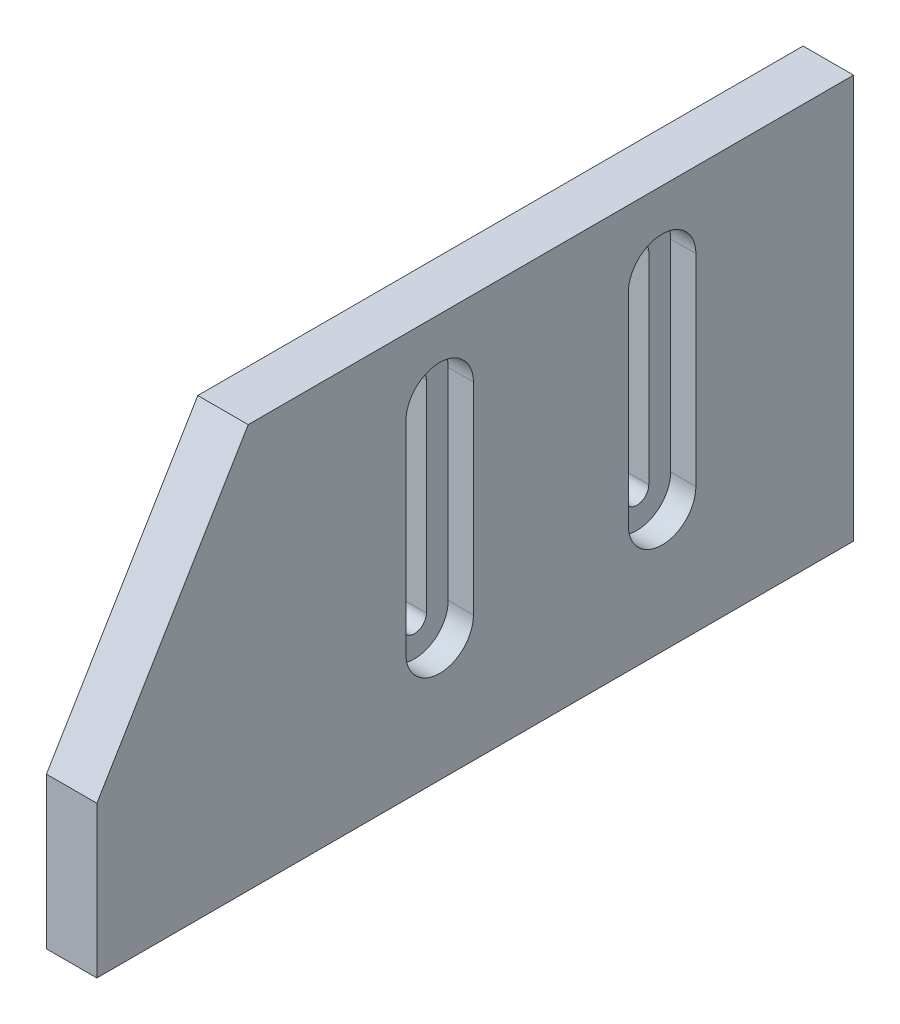
from build123d import *

# Parameters (mm, degrees)
BOSS_EXTRUDE2_DEPTH     = 3.175
CUT_EXTRUDE1_DEPTH      = 63.861792847
CUT_EXTRUDE1_DEPTH_BACK = 63.861792847
CUT_EXTRUDE3_START      = -3.175
CUT_EXTRUDE3_DEPTH      = 3.175
CUT_EXTRUDE2_DEPTH      = 77.530014537
CUT_EXTRUDE2_DEPTH_BACK = 15.24
SKETCH4_R               = 1.27


with BuildPart() as part:
    # Sketch2 → Boss-Extrude2 (new, symmetric)
    with BuildSketch(Plane(origin=(0, 0, 0), x_dir=(0, 0, -1), z_dir=(1, 0, 0))):
        Polygon((-57.15, -25.4), (38.1, -25.4), (38.1, 25.4), (-38.1, 25.4), (-57.15, -6.35), align=None)
    extrude(amount=BOSS_EXTRUDE2_DEPTH, both=True)

    # Sketch3 → Cut-Extrude1 (cut, two sides: drawn at the far end of the back side and taken through both)
    with BuildSketch(Plane(origin=(3.175, 0, 0), x_dir=(0, 0, -1), z_dir=(1, 0, 0)).offset(-CUT_EXTRUDE1_DEPTH_BACK)):
        with BuildLine():
            Line((-15.500000048, 15.875), (-15.500000048, -9.525))
            ThreePointArc((-15.500000048, -9.525), (-14, -11.025000048), (-12.499999952, -9.525))
            Line((-12.499999952, -9.525), (-12.499999952, 15.875))
            ThreePointArc((-12.499999952, 15.875), (-14, 17.375000048), (-15.500000048, 15.875))
        make_face()
        with BuildLine():
            Line((12.499999952, 15.875), (12.499999952, -9.525))
            ThreePointArc((12.499999952, -9.525), (14, -11.025000048), (15.500000048, -9.525))
            Line((15.500000048, -9.525), (15.500000048, 15.875))
            ThreePointArc((15.500000048, 15.875), (14, 17.375000048), (12.499999952, 15.875))
        make_face()
    extrude(amount=CUT_EXTRUDE1_DEPTH + CUT_EXTRUDE1_DEPTH_BACK, mode=Mode.SUBTRACT)

    # Sketch3<3> → Cut-Extrude3 (cut)
    # profile 1 of 2: a face of its own
    with BuildSketch(Plane(origin=(3.175, 0, 0), x_dir=(0, 0, -1), z_dir=(1, 0, 0)).offset(CUT_EXTRUDE3_START)):
        with BuildLine():
            Line((-18.250000009, -9.525), (-18.250000009, 15.875))
            ThreePointArc((-18.250000009, 15.875), (-14, 20.125000009), (-9.749999991, 15.875))
            Line((-9.749999991, 15.875), (-9.749999991, -9.525))
            ThreePointArc((-9.749999991, -9.525), (-14, -13.775000009), (-18.250000009, -9.525))
        make_face()
        with BuildLine():
            Line((-15.500000048, -9.525), (-15.500000048, 15.875))
            ThreePointArc((-15.500000048, 15.875), (-14, 17.375000048), (-12.499999952, 15.875))
            Line((-12.499999952, 15.875), (-12.499999952, -9.525))
            ThreePointArc((-12.499999952, -9.525), (-14, -11.025000048), (-15.500000048, -9.525))
        make_face(mode=Mode.SUBTRACT)
    # profile 2 of 2: a face of its own
    with BuildSketch(Plane(origin=(3.175, 0, 0), x_dir=(0, 0, -1), z_dir=(1, 0, 0)).offset(CUT_EXTRUDE3_START)):
        with BuildLine():
            Line((9.749999991, -9.525), (9.749999991, 15.875))
            ThreePointArc((9.749999991, 15.875), (14, 20.125000009), (18.250000009, 15.875))
            Line((18.250000009, 15.875), (18.250000009, -9.525))
            ThreePointArc((18.250000009, -9.525), (14, -13.775000009), (9.749999991, -9.525))
        make_face()
        with BuildLine():
            Line((12.499999952, -9.525), (12.499999952, 15.875))
            ThreePointArc((12.499999952, 15.875), (14, 17.375000048), (15.500000048, 15.875))
            Line((15.500000048, 15.875), (15.500000048, -9.525))
            ThreePointArc((15.500000048, -9.525), (14, -11.025000048), (12.499999952, -9.525))
        make_face(mode=Mode.SUBTRACT)
    extrude(amount=CUT_EXTRUDE3_DEPTH, mode=Mode.SUBTRACT)

    # Sketch4 → Cut-Extrude2 (cut, two sides: drawn at the far end of the back side and taken through both)
    with BuildSketch(Plane.XZ.offset(25.4).offset(-CUT_EXTRUDE2_DEPTH_BACK)):
        with Locations((0, 25.4)):
            Circle(SKETCH4_R)
        Circle(SKETCH4_R)
        with Locations((0, -25.4)):
            Circle(SKETCH4_R)
        with Locations((0, 34.925)):
            Circle(SKETCH4_R)
        with Locations((0, 44.45)):
            Circle(SKETCH4_R)
    extrude(amount=CUT_EXTRUDE2_DEPTH + CUT_EXTRUDE2_DEPTH_BACK, mode=Mode.SUBTRACT)


solid = part.part
